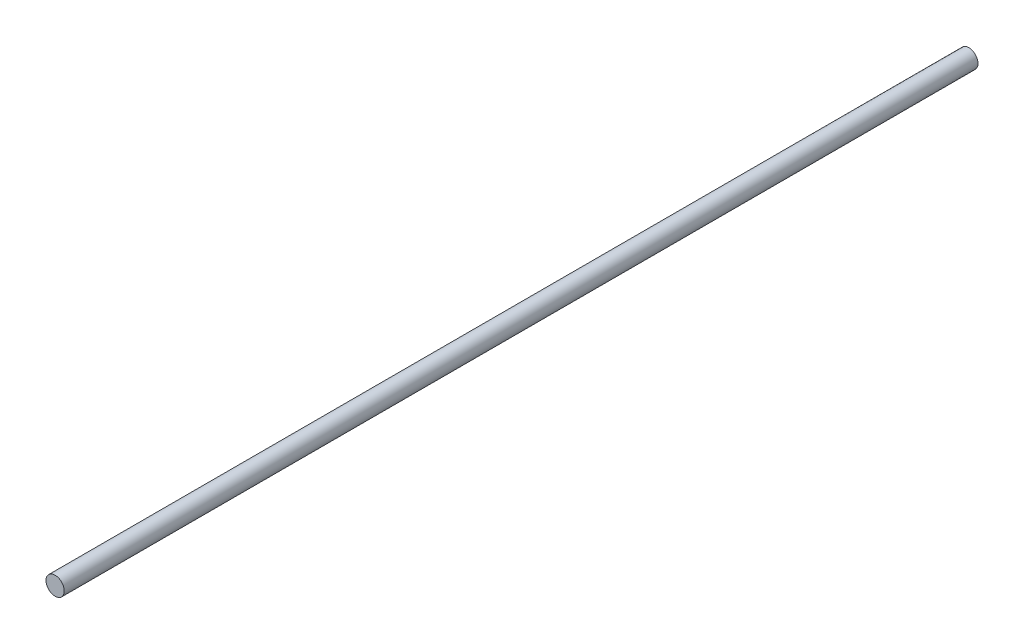
from build123d import *

# Parameters (mm, degrees)
SKETCH2_R           = 1
BOSS_EXTRUDE1_DEPTH = 50


with BuildPart() as part:
    # Sketch2 → Boss-Extrude1 (new, symmetric)
    with BuildSketch(Plane.XY):
        Circle(SKETCH2_R)
    extrude(amount=BOSS_EXTRUDE1_DEPTH, both=True)


solid = part.part
